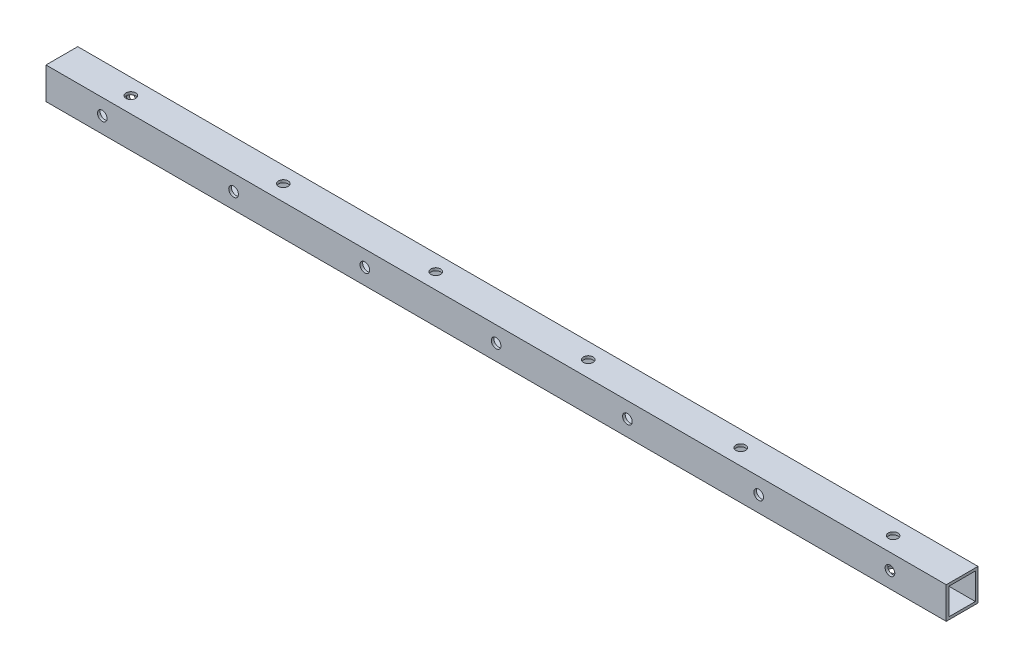
from build123d import *

# Parameters (mm, degrees)
SKETCH1_W               = 19.05
SKETCH1_H               = 19.05
SKETCH1_W_2             = 15.875
SKETCH1_H_2             = 15.875
TUBE_DEPTH              = 539.9532
SKETCH2_R               = 2.8956
REARWALLHOLES_DEPTH     = 541.373099178
LPATTERN1_COUNT         = 7
LPATTERN1_PITCH         = 78.74
SKETCH3_R               = 2.8956
REARTOPHOLEMASTER_DEPTH = 541.373099178
LPATTERN2_COUNT         = 6
LPATTERN2_PITCH         = 91.44


with BuildPart() as part:
    # Sketch1 → Tube (new body)
    with BuildSketch(Plane(origin=(0, 0, 0), x_dir=(0, -1, 0), z_dir=(1, 0, 0))):
        Rectangle(SKETCH1_W, SKETCH1_H)
        Rectangle(SKETCH1_W_2, SKETCH1_H_2, mode=Mode.SUBTRACT)
    extrude(amount=TUBE_DEPTH)

    # Sketch2 → RearWallHoles (cut, through all)
    with BuildSketch(Plane.XY.offset(9.525)):
        with Locations((506.1966, 0)):
            Circle(SKETCH2_R)
    rearwallholes = extrude(amount=-REARWALLHOLES_DEPTH, mode=Mode.SUBTRACT)

    # LPattern1: RearWallHoles ×7
    with Locations(*[(-i * LPATTERN1_PITCH, 0, 0) for i in range(1, LPATTERN1_COUNT)]):
        add(rearwallholes, mode=Mode.SUBTRACT)

    # Sketch3 → RearTopHoleMaster (cut, through all)
    with BuildSketch(Plane(origin=(0, 9.525, 0), x_dir=(1, 0, 0), z_dir=(0, 1, 0))):
        with Locations(Location((41.3766, 0, 0), (0, 0, 270))):
            Circle(SKETCH3_R)
    reartopholemaster = extrude(amount=-REARTOPHOLEMASTER_DEPTH, mode=Mode.SUBTRACT)

    # LPattern2: RearTopHoleMaster ×6
    with Locations(*[(i * LPATTERN2_PITCH, 0, 0) for i in range(1, LPATTERN2_COUNT)]):
        add(reartopholemaster, mode=Mode.SUBTRACT)


solid = part.part
